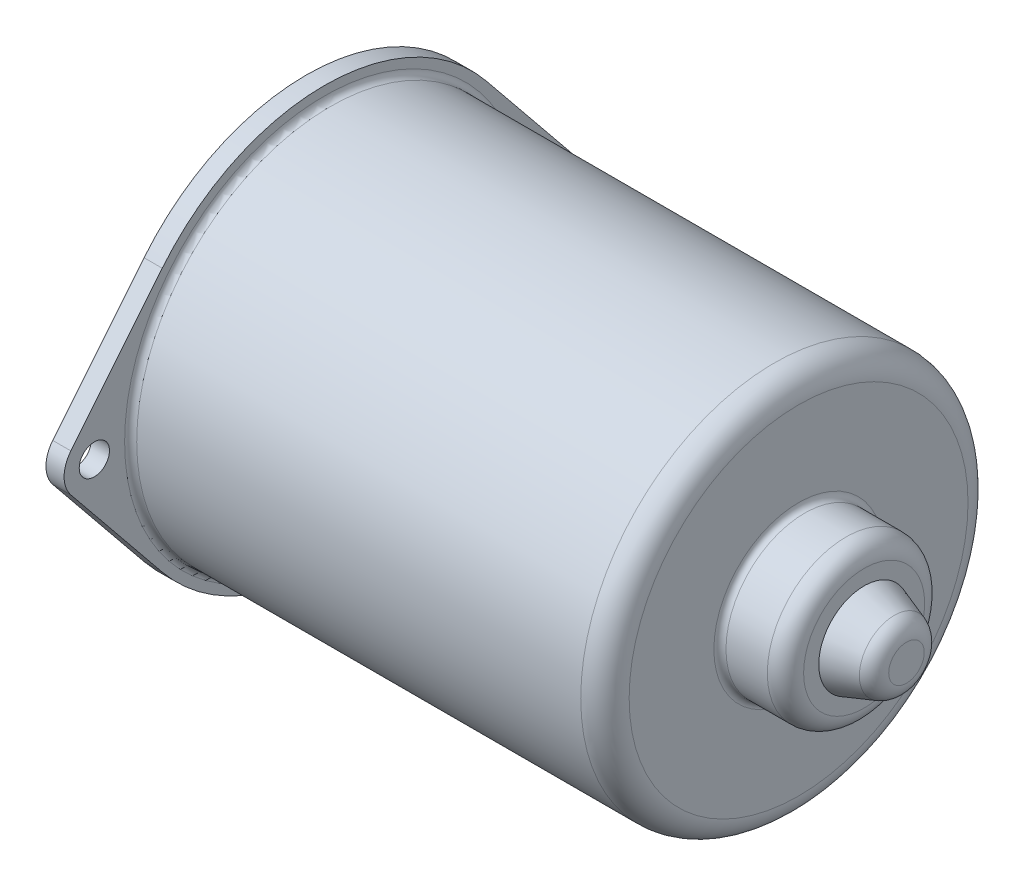
from build123d import *

# Parameters (mm, degrees)
ESQUISSE2_R             = 49.06578461
ENL_V_MAT_EXTRU_1_DEPTH = 118.868532804
ESQUISSE3_R             = 2.5
ENL_V_MAT_EXTRU_2_DEPTH = 114.499960464


with BuildPart() as part:
    # Esquisse1 → Révolution1 (revolve)
    with BuildSketch(Plane.XY, mode=Mode.PRIVATE) as r_volution1_sk:
        with BuildLine():
            Line((-43.841564166, 45), (-43.841564166, 29))
            Line((-43.841564166, 29), (33.537566626, 29))
            ThreePointArc((33.537566626, 29), (34.244673407, 28.707106781), (34.537566626, 28))
            Line((34.537566626, 28), (34.537566626, 14))
            ThreePointArc((34.537566626, 14), (35.709139501, 11.171572875), (38.537566626, 10))
            Line((38.537566626, 10), (45.370284953, 10))
            Line((45.370284953, 10), (45.370284953, 5.365359199))
            Line((45.370284953, 5.365359199), (52.370284953, 2.936913115))
            Line((52.370284953, 2.936913115), (52.370284953, 0))
            Line((52.370284953, 0), (55.370284953, 0))
            Line((55.370284953, 0), (55.370284953, 2.936913115))
            ThreePointArc((55.370284953, 2.936913115), (54.814647694, 4.676191928), (53.35355776, 5.771198666))
            Line((53.35355776, 5.771198666), (48.370284953, 7.5))
            Line((48.370284953, 7.5), (48.370284953, 10))
            ThreePointArc((48.370284953, 10), (47.491605296, 12.121320344), (45.370284953, 13))
            Line((45.370284953, 13), (38.537566626, 13))
            ThreePointArc((38.537566626, 13), (37.830459844, 13.292893219), (37.537566626, 14))
            Line((37.537566626, 14), (37.537566626, 28))
            ThreePointArc((37.537566626, 28), (36.36599375, 30.828427125), (33.537566626, 32))
            Line((33.537566626, 32), (-39.841564166, 32))
            ThreePointArc((-39.841564166, 32), (-40.548670947, 32.292893219), (-40.841564166, 33))
            Line((-40.841564166, 33), (-40.841564166, 45))
            Line((-40.841564166, 45), (-43.841564166, 45))
        make_face()
    revolve(r_volution1_sk.sketch.rotate(Axis((-73.163253383, 0, 0), (1, 0, 0)), 90), axis=Axis((-73.163253383, 0, 0), (1, 0, 0)))

    # Esquisse2 → Enlèv. mat.-Extru.1 (cut, through all)
    with BuildSketch(Plane.ZY.offset(43.841564166)):
        Circle(ESQUISSE2_R)
        with BuildLine():
            Line((-41.881578947, 3.151720939), (-26.782894737, 21.746874477))
            ThreePointArc((-26.782894737, 21.746874477), (0, 34.5), (26.782894737, 21.746874477))
            Line((26.782894737, 21.746874477), (41.881578947, 3.151720939))
            ThreePointArc((41.881578947, 3.151720939), (43, 0), (41.881578947, -3.151720939))
            Line((41.881578947, -3.151720939), (26.782894737, -21.746874477))
            ThreePointArc((26.782894737, -21.746874477), (0, -34.5), (-26.782894737, -21.746874477))
            Line((-26.782894737, -21.746874477), (-41.881578947, -3.151720939))
            ThreePointArc((-41.881578947, -3.151720939), (-43, 0), (-41.881578947, 3.151720939))
        make_face(mode=Mode.SUBTRACT)
    extrude(amount=-ENL_V_MAT_EXTRU_1_DEPTH, mode=Mode.SUBTRACT)

    # Esquisse3 → Enlèv. mat.-Extru.2 (cut, through all)
    with BuildSketch(Plane.ZY.offset(43.841564166)):
        with Locations((38, 0)):
            Circle(ESQUISSE3_R)
        with Locations((-38, 0)):
            Circle(ESQUISSE3_R)
    extrude(amount=-ENL_V_MAT_EXTRU_2_DEPTH, mode=Mode.SUBTRACT)


solid = part.part
